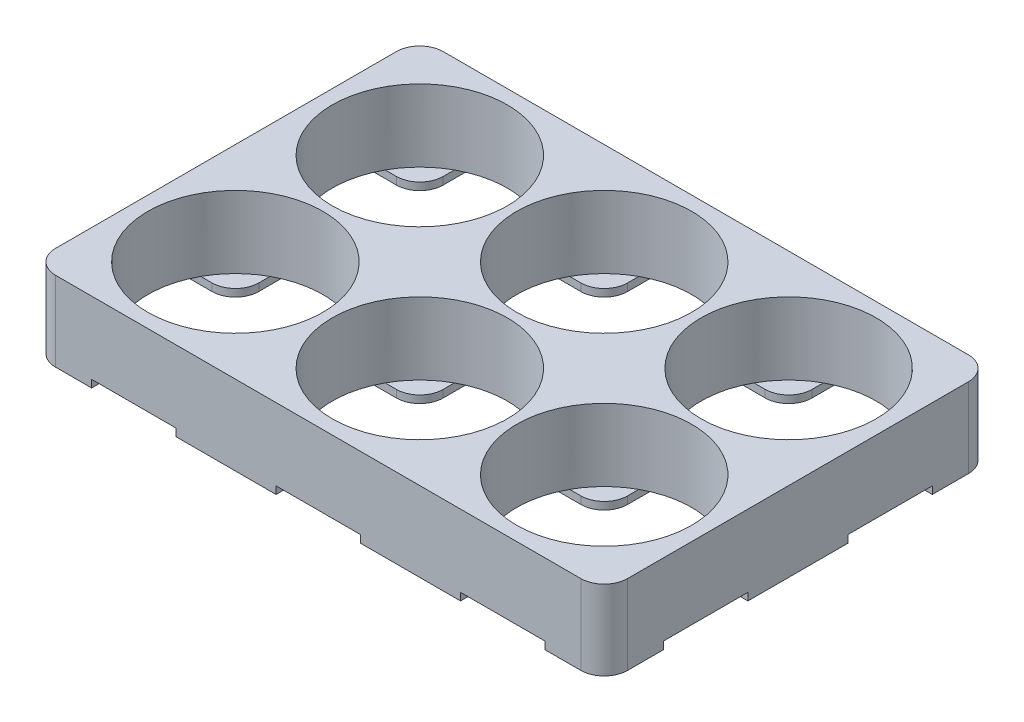
from build123d import *

# Parameters (mm, degrees)
SKETCH3_W                       = 61.1
SKETCH3_H                       = 41.4
SKETCH3_R                       = 9.35
BOSS_EXTRUDE1_DEPTH             = 66
SKETCH4_R                       = 3.080003589
CUT_EXTRUDE1_DEPTH              = 76.616086252
BOSS_EXTRUDE2_REACH             = 77.616
SKETCH5_W                       = 61.1
SKETCH5_H                       = 1
BOSS_EXTRUDE2_DIRECTION_2_REACH = 77.616
CUT_EXTRUDE3_DEPTH              = 76.616086252
CUT_EXTRUDE3_DEPTH_BACK         = 76.616086252
SKETCH5_3_W                     = 58.1
SKETCH5_3_H                     = 49
SKETCH7_R                       = 9.35
CUT_EXTRUDE4_DEPTH              = 76.616086252
BOSS_EXTRUDE3_START             = -20.7
SKETCH8_R                       = 8
SKETCH8_R_2                     = 5.5
BOSS_EXTRUDE3_DEPTH             = 41.4
CUT_EXTRUDE6_DEPTH              = 86.672588965
CUT_EXTRUDE6_DEPTH_BACK         = 86.672588965
SKETCH10_R                      = 8
SKETCH10_R_2                    = 2.25
BOSS_EXTRUDE4_DEPTH             = 5
SKETCH11_W                      = 61.1
SKETCH11_H                      = 41.4
SKETCH11_W_2                    = 58.1
SKETCH11_H_2                    = 38.4
BOSS_EXTRUDE5_DEPTH             = 4
CUT_EXTRUDE7_START              = -0.8
CUT_EXTRUDE7_DEPTH              = 0.8
CUT_EXTRUDE8_START              = -66
CUT_EXTRUDE8_DEPTH              = 0.8
CUT_EXTRUDE9_DEPTH              = 89.790723051
CUT_EXTRUDE9_DEPTH_BACK         = 89.790723051
SKETCH13_W                      = 101.1
SKETCH13_H                      = 61.5
SKETCH13_W_2                    = 20
SKETCH13_H_2                    = 8.5
SKETCH14_W                      = 6.35
SKETCH14_H                      = 9
SKETCH14_W_2                    = 9
SKETCH14_W_3                    = 10.7
SKETCH14_H_2                    = 10.7
SKETCH14_H_3                    = 6.35
CUT_EXTRUDE10_DEPTH             = 0.8
BOSS_EXTRUDE6_DEPTH             = 0.8
FILLET1_R                       = 2.5


with BuildPart() as part:
    # Sketch3 → Boss-Extrude1 (new body)
    with BuildSketch(Plane(origin=(0, 0, 0), x_dir=(1, 0, 0), z_dir=(0, 1, 0))):
        Rectangle(SKETCH3_W, SKETCH3_H)
        with Locations(Location((-19.7, 9.85, 0), (0, 0, 270))):
            Circle(SKETCH3_R, mode=Mode.SUBTRACT)
        with Locations(Location((0, 9.85, 0), (0, 0, 270))):
            Circle(SKETCH3_R, mode=Mode.SUBTRACT)
        with Locations(Location((19.7, 9.85, 0), (0, 0, 270))):
            Circle(SKETCH3_R, mode=Mode.SUBTRACT)
        with Locations(Location((-19.7, -9.85, 0), (0, 0, 270))):
            Circle(SKETCH3_R, mode=Mode.SUBTRACT)
        with Locations(Location((0, -9.85, 0), (0, 0, 270))):
            Circle(SKETCH3_R, mode=Mode.SUBTRACT)
        with Locations(Location((19.7, -9.85, 0), (0, 0, 270))):
            Circle(SKETCH3_R, mode=Mode.SUBTRACT)
    extrude(amount=BOSS_EXTRUDE1_DEPTH)

    # Sketch4 → Cut-Extrude1 (cut, through all)
    with BuildSketch(Plane(origin=(0, 0, 0), x_dir=(1, 0, 0), z_dir=(0, 1, 0))):
        with Locations(Location((-9.85, 0, 0), (0, 0, 270))):
            Circle(SKETCH4_R)
        with Locations(Location((9.85, 0, 0), (0, 0, 270))):
            Circle(SKETCH4_R)
        with BuildLine():
            Line((-4.438468204, 19.2), (-15.261531796, 19.2))
            ThreePointArc((-15.261531796, 19.2), (-12.756480414, 17.525287341), (-10.839977427, 15.2))
            Line((-10.839977427, 15.2), (-8.860022573, 15.2))
            ThreePointArc((-8.860022573, 15.2), (-6.943519586, 17.525287341), (-4.438468204, 19.2))
        make_face()
        with BuildLine():
            Line((15.261531796, 19.2), (4.438468204, 19.2))
            ThreePointArc((4.438468204, 19.2), (6.943519586, 17.525287341), (8.860022573, 15.2))
            Line((8.860022573, 15.2), (10.839977427, 15.2))
            ThreePointArc((10.839977427, 15.2), (12.756480414, 17.525287341), (15.261531796, 19.2))
        make_face()
        with BuildLine():
            Line((29.05, -5.411531796), (29.05, 5.411531796))
            ThreePointArc((29.05, 5.411531796), (27.375287341, 2.906480414), (25.05, 0.989977427))
            Line((25.05, 0.989977427), (25.05, -0.989977427))
            ThreePointArc((25.05, -0.989977427), (27.375287341, -2.906480414), (29.05, -5.411531796))
        make_face()
        with BuildLine():
            Line((29.05, -19.2), (29.05, -14.288468204))
            ThreePointArc((29.05, -14.288468204), (27.018555185, -17.168555185), (24.138468204, -19.2))
            Line((24.138468204, -19.2), (29.05, -19.2))
        make_face()
        with BuildLine():
            Line((29.05, 19.2), (24.138468204, 19.2))
            ThreePointArc((24.138468204, 19.2), (27.018555185, 17.168555185), (29.05, 14.288468204))
            Line((29.05, 14.288468204), (29.05, 19.2))
        make_face()
        with BuildLine():
            ThreePointArc((15.261531796, -19.2), (12.756480414, -17.525287341), (10.839977427, -15.2))
            Line((10.839977427, -15.2), (8.860022573, -15.2))
            ThreePointArc((8.860022573, -15.2), (6.943519586, -17.525287341), (4.438468204, -19.2))
            Line((4.438468204, -19.2), (15.261531796, -19.2))
        make_face()
        with BuildLine():
            ThreePointArc((-4.438468204, -19.2), (-6.943519586, -17.525287341), (-8.860022573, -15.2))
            Line((-8.860022573, -15.2), (-10.839977427, -15.2))
            ThreePointArc((-10.839977427, -15.2), (-12.756480414, -17.525287341), (-15.261531796, -19.2))
            Line((-15.261531796, -19.2), (-4.438468204, -19.2))
        make_face()
        with BuildLine():
            ThreePointArc((-24.138468204, -19.2), (-27.018555185, -17.168555185), (-29.05, -14.288468204))
            Line((-29.05, -14.288468204), (-29.05, -19.2))
            Line((-29.05, -19.2), (-24.138468204, -19.2))
        make_face()
        with BuildLine():
            ThreePointArc((-25.05, 0.989977427), (-27.375287341, 2.906480414), (-29.05, 5.411531796))
            Line((-29.05, 5.411531796), (-29.05, -5.411531796))
            ThreePointArc((-29.05, -5.411531796), (-27.375287341, -2.906480414), (-25.05, -0.989977427))
            Line((-25.05, -0.989977427), (-25.05, 0.989977427))
        make_face()
        with BuildLine():
            ThreePointArc((-29.05, 14.288468204), (-27.018555185, 17.168555185), (-24.138468204, 19.2))
            Line((-24.138468204, 19.2), (-29.05, 19.2))
            Line((-29.05, 19.2), (-29.05, 14.288468204))
        make_face()
    extrude(amount=CUT_EXTRUDE1_DEPTH, mode=Mode.SUBTRACT)

    # Boss-Extrude2: up to this face of the body (flat: up to its plane)
    boss_extrude2_end = Plane(part.part.faces().sort_by_distance((0, 33, 20.7))[0])
    # Sketch5 → Boss-Extrude2 (add, up to the picked face)
    with BuildSketch(Plane.XY, mode=Mode.PRIVATE) as boss_extrude2_sk1:
        with Locations((0, 58)):
            Rectangle(SKETCH5_W, SKETCH5_H)
    boss_extrude2_tool1 = split(extrude(boss_extrude2_sk1.sketch, amount=BOSS_EXTRUDE2_REACH, mode=Mode.PRIVATE), bisect_by=boss_extrude2_end, keep=Keep.BOTH, mode=Mode.PRIVATE)
    # Sketch5 → Boss-Extrude2 (add, up to the picked face)
    with BuildSketch(Plane.XY, mode=Mode.PRIVATE) as boss_extrude2_sk2:
        with Locations((0, 8)):
            Rectangle(SKETCH5_W, SKETCH5_H)
    boss_extrude2_tool2 = split(extrude(boss_extrude2_sk2.sketch, amount=BOSS_EXTRUDE2_REACH, mode=Mode.PRIVATE), bisect_by=boss_extrude2_end, keep=Keep.BOTH, mode=Mode.PRIVATE)
    add(boss_extrude2_tool1.solids().sort_by(Axis((0, 58, 0), (0, 0, 1)))[0])
    add(boss_extrude2_tool2.solids().sort_by(Axis((0, 8, 0), (0, 0, 1)))[0])

    # Boss-Extrude2 direction 2: up to this face of the body (flat: up to its plane)
    boss_extrude2_direction_2_end = Plane(part.part.faces().sort_by_distance((0, 33, -20.7))[0])
    # Sketch5 → Boss-Extrude2 direction 2 (add, up to the picked face)
    with BuildSketch(Plane.XY, mode=Mode.PRIVATE) as boss_extrude2_direction_2_sk1:
        with Locations((0, 58)):
            Rectangle(SKETCH5_W, SKETCH5_H)
    boss_extrude2_direction_2_tool1 = split(extrude(boss_extrude2_direction_2_sk1.sketch, amount=-BOSS_EXTRUDE2_DIRECTION_2_REACH, mode=Mode.PRIVATE), bisect_by=boss_extrude2_direction_2_end, keep=Keep.BOTH, mode=Mode.PRIVATE)
    # Sketch5 → Boss-Extrude2 direction 2 (add, up to the picked face)
    with BuildSketch(Plane.XY, mode=Mode.PRIVATE) as boss_extrude2_direction_2_sk2:
        with Locations((0, 8)):
            Rectangle(SKETCH5_W, SKETCH5_H)
    boss_extrude2_direction_2_tool2 = split(extrude(boss_extrude2_direction_2_sk2.sketch, amount=-BOSS_EXTRUDE2_DIRECTION_2_REACH, mode=Mode.PRIVATE), bisect_by=boss_extrude2_direction_2_end, keep=Keep.BOTH, mode=Mode.PRIVATE)
    add(boss_extrude2_direction_2_tool1.solids().sort_by(Axis((0, 58, 0), (0, 0, -1)))[0])
    add(boss_extrude2_direction_2_tool2.solids().sort_by(Axis((0, 8, 0), (0, 0, -1)))[0])

    # Sketch5<3> → Cut-Extrude3 (cut, two sides: drawn at the far end of the back side and taken through both)
    with BuildSketch(Plane.XY.offset(-CUT_EXTRUDE3_DEPTH_BACK)):
        with Locations((0, 33)):
            Rectangle(SKETCH5_3_W, SKETCH5_3_H)
    extrude(amount=CUT_EXTRUDE3_DEPTH + CUT_EXTRUDE3_DEPTH_BACK, mode=Mode.SUBTRACT)

    # Sketch7 → Cut-Extrude4 (cut, through all)
    with BuildSketch(Plane(origin=(0, 0, 0), x_dir=(1, 0, 0), z_dir=(0, 1, 0))):
        with Locations(Location((-19.7, 9.85, 0), (0, 0, 180))):
            Circle(SKETCH7_R)
        with Locations(Location((0, 9.85, 0), (0, 0, 270))):
            Circle(SKETCH7_R)
        with Locations((19.7, 9.85)):
            Circle(SKETCH7_R)
        with Locations((19.7, -9.85)):
            Circle(SKETCH7_R)
        with Locations(Location((0, -9.85, 0), (0, 0, 270))):
            Circle(SKETCH7_R)
        with Locations(Location((-19.7, -9.85, 0), (0, 0, 180))):
            Circle(SKETCH7_R)
    extrude(amount=CUT_EXTRUDE4_DEPTH, mode=Mode.SUBTRACT)

    # Sketch8 → Boss-Extrude3 (add)
    # profile 1 of 8: a face of its own
    with BuildSketch(Plane.XY.offset(BOSS_EXTRUDE3_START)):
        with BuildLine():
            Line((-30.55, 63.5), (-42.55, 63.5))
            ThreePointArc((-42.55, 63.5), (-36.893145751, 61.156854249), (-34.55, 55.5))
            ThreePointArc((-34.55, 55.5), (-36.893145751, 49.843145751), (-42.55, 47.5))
            Line((-42.55, 47.5), (-30.55, 47.5))
            Line((-30.55, 47.5), (-30.55, 63.5))
        make_face()
    # profile 2 of 8: a face of its own
    with BuildSketch(Plane.XY.offset(BOSS_EXTRUDE3_START)):
        with Locations((-42.55, 55.5)):
            Circle(SKETCH8_R)
        with Locations(Location((-42.55, 55.5, 0), (0, 0, 180))):
            Circle(SKETCH8_R_2, mode=Mode.SUBTRACT)
    # profile 3 of 8: a face of its own
    with BuildSketch(Plane.XY.offset(BOSS_EXTRUDE3_START)):
        with BuildLine():
            Line((30.55, 47.5), (42.55, 47.5))
            ThreePointArc((42.55, 47.5), (34.55, 55.5), (42.55, 63.5))
            Line((42.55, 63.5), (30.55, 63.5))
            Line((30.55, 63.5), (30.55, 47.5))
        make_face()
    # profile 4 of 8: a face of its own
    with BuildSketch(Plane.XY.offset(BOSS_EXTRUDE3_START)):
        with Locations((42.55, 55.5)):
            Circle(SKETCH8_R)
        with Locations(Location((42.55, 55.5, 0), (0, 0, 180))):
            Circle(SKETCH8_R_2, mode=Mode.SUBTRACT)
    # profile 5 of 8: a face of its own
    with BuildSketch(Plane.XY.offset(BOSS_EXTRUDE3_START)):
        with BuildLine():
            Line((30.55, 2.5), (42.55, 2.5))
            ThreePointArc((42.55, 2.5), (34.55, 10.5), (42.55, 18.5))
            Line((42.55, 18.5), (30.55, 18.5))
            Line((30.55, 18.5), (30.55, 2.5))
        make_face()
    # profile 6 of 8: a face of its own
    with BuildSketch(Plane.XY.offset(BOSS_EXTRUDE3_START)):
        with Locations((42.55, 10.5)):
            Circle(SKETCH8_R)
        with Locations(Location((42.55, 10.5, 0), (0, 0, 180))):
            Circle(SKETCH8_R_2, mode=Mode.SUBTRACT)
    # profile 7 of 8: a face of its own
    with BuildSketch(Plane.XY.offset(BOSS_EXTRUDE3_START)):
        with Locations((-42.55, 10.5)):
            Circle(SKETCH8_R)
        with Locations(Location((-42.55, 10.5, 0), (0, 0, 180))):
            Circle(SKETCH8_R_2, mode=Mode.SUBTRACT)
    # profile 8 of 8: a face of its own
    with BuildSketch(Plane.XY.offset(BOSS_EXTRUDE3_START)):
        with BuildLine():
            Line((-30.55, 18.5), (-42.55, 18.5))
            ThreePointArc((-42.55, 18.5), (-36.893145751, 16.156854249), (-34.55, 10.5))
            ThreePointArc((-34.55, 10.5), (-36.893145751, 4.843145751), (-42.55, 2.5))
            Line((-42.55, 2.5), (-30.55, 2.5))
            Line((-30.55, 2.5), (-30.55, 18.5))
        make_face()
    extrude(amount=BOSS_EXTRUDE3_DEPTH)

    # Sketch9 → Cut-Extrude6 (cut, two sides: drawn at the far end of the back side and taken through both)
    with BuildSketch(Plane(origin=(0, 0, 0), x_dir=(1, 0, 0), z_dir=(0, 1, 0)).offset(-CUT_EXTRUDE6_DEPTH_BACK)):
        Polygon((-50.55, -20.7), (-30.55, -20.7), (-30.55, -4.3), (-46.55, 5.7), (-50.55, 5.7), align=None)
        Polygon((30.55, -20.7), (30.55, -4.3), (46.55, 5.7), (50.55, 5.7), (50.55, -20.7), align=None)
    extrude(amount=CUT_EXTRUDE6_DEPTH + CUT_EXTRUDE6_DEPTH_BACK, mode=Mode.SUBTRACT)

    # Sketch10 → Boss-Extrude4 (add)
    # profile 1 of 4: a face of its own
    with BuildSketch(Plane(origin=(0, 0, -20.7), x_dir=(-1, 0, 0), z_dir=(0, 0, -1))):
        with Locations((42.55, 10.5)):
            Circle(SKETCH10_R)
        with Locations((42.55, 10.5)):
            Circle(SKETCH10_R_2, mode=Mode.SUBTRACT)
    # profile 2 of 4: a face of its own
    with BuildSketch(Plane(origin=(0, 0, -20.7), x_dir=(-1, 0, 0), z_dir=(0, 0, -1))):
        with Locations((42.55, 55.5)):
            Circle(SKETCH10_R)
        with Locations((42.55, 55.5)):
            Circle(SKETCH10_R_2, mode=Mode.SUBTRACT)
    # profile 3 of 4: a face of its own
    with BuildSketch(Plane(origin=(0, 0, -20.7), x_dir=(-1, 0, 0), z_dir=(0, 0, -1))):
        with Locations((-42.55, 55.5)):
            Circle(SKETCH10_R)
        with Locations((-42.55, 55.5)):
            Circle(SKETCH10_R_2, mode=Mode.SUBTRACT)
    # profile 4 of 4: a face of its own
    with BuildSketch(Plane(origin=(0, 0, -20.7), x_dir=(-1, 0, 0), z_dir=(0, 0, -1))):
        with Locations((-42.55, 10.5)):
            Circle(SKETCH10_R)
        with Locations((-42.55, 10.5)):
            Circle(SKETCH10_R_2, mode=Mode.SUBTRACT)
    extrude(amount=-BOSS_EXTRUDE4_DEPTH)

    # Sketch11 → Boss-Extrude5 (add)
    with BuildSketch(Plane(origin=(0, 66, 0), x_dir=(1, 0, 0), z_dir=(0, 1, 0))):
        Rectangle(SKETCH11_W, SKETCH11_H)
        Rectangle(SKETCH11_W_2, SKETCH11_H_2, mode=Mode.SUBTRACT)
    extrude(amount=BOSS_EXTRUDE5_DEPTH)

    # Sketch12 → Cut-Extrude7 (cut)
    with BuildSketch(Plane(origin=(0, 66, 0), x_dir=(1, 0, 0), z_dir=(0, 1, 0)).offset(CUT_EXTRUDE7_START)):
        with BuildLine():
            Line((-24.2, 14.35), (-24.2, 1.654116887))
            ThreePointArc((-24.2, 1.654116887), (-19.7, 0.5), (-15.2, 1.654116887))
            Line((-15.2, 1.654116887), (-15.2, 5.35))
            Line((-15.2, 5.35), (-11.504116887, 5.35))
            ThreePointArc((-11.504116887, 5.35), (-10.35, 9.85), (-11.504116887, 14.35))
            Line((-11.504116887, 14.35), (-24.2, 14.35))
        make_face()
        with BuildLine():
            Line((-24.2, -1.654116887), (-24.2, -14.35))
            Line((-24.2, -14.35), (-11.504116887, -14.35))
            ThreePointArc((-11.504116887, -14.35), (-10.35, -9.85), (-11.504116887, -5.35))
            Line((-11.504116887, -5.35), (-15.2, -5.35))
            Line((-15.2, -5.35), (-15.2, -1.654116887))
            ThreePointArc((-15.2, -1.654116887), (-19.7, -0.5), (-24.2, -1.654116887))
        make_face()
        with BuildLine():
            ThreePointArc((-11.504116887, -5.35), (-10.35, -9.85), (-11.504116887, -14.35))
            Line((-11.504116887, -14.35), (-8.195883113, -14.35))
            ThreePointArc((-8.195883113, -14.35), (-9.35, -9.85), (-8.195883113, -5.35))
            Line((-8.195883113, -5.35), (-11.504116887, -5.35))
        make_face()
        with BuildLine():
            ThreePointArc((-8.195883113, -5.35), (-9.35, -9.85), (-8.195883113, -14.35))
            Line((-8.195883113, -14.35), (8.195883113, -14.35))
            ThreePointArc((8.195883113, -14.35), (9.056876037, -12.172820795), (9.35, -9.85))
            ThreePointArc((9.35, -9.85), (9.056876037, -7.527179205), (8.195883113, -5.35))
            Line((8.195883113, -5.35), (4.5, -5.35))
            Line((4.5, -5.35), (4.5, -1.654116887))
            ThreePointArc((4.5, -1.654116887), (0, -0.5), (-4.5, -1.654116887))
            Line((-4.5, -1.654116887), (-4.5, -5.35))
            Line((-4.5, -5.35), (-8.195883113, -5.35))
        make_face()
        with BuildLine():
            Line((-4.5, 5.35), (-4.5, 1.654116887))
            ThreePointArc((-4.5, 1.654116887), (0, 0.5), (4.5, 1.654116887))
            Line((4.5, 1.654116887), (4.5, 5.35))
            Line((4.5, 5.35), (8.195883113, 5.35))
            ThreePointArc((8.195883113, 5.35), (9.056876037, 7.527179205), (9.35, 9.85))
            ThreePointArc((9.35, 9.85), (9.056876037, 12.172820795), (8.195883113, 14.35))
            Line((8.195883113, 14.35), (-8.195883113, 14.35))
            ThreePointArc((-8.195883113, 14.35), (-9.35, 9.85), (-8.195883113, 5.35))
            Line((-8.195883113, 5.35), (-4.5, 5.35))
        make_face()
        with BuildLine():
            Line((-8.195883113, 14.35), (-11.504116887, 14.35))
            ThreePointArc((-11.504116887, 14.35), (-10.35, 9.85), (-11.504116887, 5.35))
            Line((-11.504116887, 5.35), (-8.195883113, 5.35))
            ThreePointArc((-8.195883113, 5.35), (-9.35, 9.85), (-8.195883113, 14.35))
        make_face()
        with BuildLine():
            Line((-4.5, 1.654116887), (-4.5, -1.654116887))
            ThreePointArc((-4.5, -1.654116887), (0, -0.5), (4.5, -1.654116887))
            Line((4.5, -1.654116887), (4.5, 1.654116887))
            ThreePointArc((4.5, 1.654116887), (0, 0.5), (-4.5, 1.654116887))
        make_face()
        with BuildLine():
            ThreePointArc((11.504116887, -5.35), (10.35, -9.85), (11.504116887, -14.35))
            Line((11.504116887, -14.35), (24.2, -14.35))
            Line((24.2, -14.35), (24.2, -1.654116887))
            ThreePointArc((24.2, -1.654116887), (19.7, -0.5), (15.2, -1.654116887))
            Line((15.2, -1.654116887), (15.2, -5.35))
            Line((15.2, -5.35), (11.504116887, -5.35))
        make_face()
        with BuildLine():
            Line((24.2, 14.35), (11.504116887, 14.35))
            ThreePointArc((11.504116887, 14.35), (10.35, 9.85), (11.504116887, 5.35))
            Line((11.504116887, 5.35), (15.2, 5.35))
            Line((15.2, 5.35), (15.2, 1.654116887))
            ThreePointArc((15.2, 1.654116887), (19.7, 0.5), (24.2, 1.654116887))
            Line((24.2, 1.654116887), (24.2, 14.35))
        make_face()
        with BuildLine():
            Line((15.2, 0), (24.2, 0))
            Line((24.2, 0), (24.2, 1.654116887))
            ThreePointArc((24.2, 1.654116887), (19.7, 0.5), (15.2, 1.654116887))
            Line((15.2, 1.654116887), (15.2, 0))
        make_face()
        with BuildLine():
            ThreePointArc((15.2, -1.654116887), (19.7, -0.5), (24.2, -1.654116887))
            Line((24.2, -1.654116887), (24.2, 0))
            Line((24.2, 0), (15.2, 0))
            Line((15.2, 0), (15.2, -1.654116887))
        make_face()
        with BuildLine():
            ThreePointArc((9.35, -9.85), (9.056876037, -12.172820795), (8.195883113, -14.35))
            Line((8.195883113, -14.35), (11.504116887, -14.35))
            ThreePointArc((11.504116887, -14.35), (10.35, -9.85), (11.504116887, -5.35))
            Line((11.504116887, -5.35), (8.195883113, -5.35))
            ThreePointArc((8.195883113, -5.35), (9.056876037, -7.527179205), (9.35, -9.85))
        make_face()
        with BuildLine():
            Line((11.504116887, 14.35), (8.195883113, 14.35))
            ThreePointArc((8.195883113, 14.35), (9.056876037, 12.172820795), (9.35, 9.85))
            ThreePointArc((9.35, 9.85), (9.056876037, 7.527179205), (8.195883113, 5.35))
            Line((8.195883113, 5.35), (11.504116887, 5.35))
            ThreePointArc((11.504116887, 5.35), (10.35, 9.85), (11.504116887, 14.35))
        make_face()
        with BuildLine():
            Line((-24.2, 1.654116887), (-24.2, -1.654116887))
            ThreePointArc((-24.2, -1.654116887), (-19.7, -0.5), (-15.2, -1.654116887))
            Line((-15.2, -1.654116887), (-15.2, 1.654116887))
            ThreePointArc((-15.2, 1.654116887), (-19.7, 0.5), (-24.2, 1.654116887))
        make_face()
    extrude(amount=CUT_EXTRUDE7_DEPTH, mode=Mode.SUBTRACT)

    # Sketch12<3> → Cut-Extrude8 (cut)
    with BuildSketch(Plane(origin=(0, 66, 0), x_dir=(1, 0, 0), z_dir=(0, 1, 0)).offset(CUT_EXTRUDE8_START)):
        with BuildLine():
            Line((-24.2, 14.35), (-24.2, 1.654116887))
            ThreePointArc((-24.2, 1.654116887), (-19.7, 0.5), (-15.2, 1.654116887))
            Line((-15.2, 1.654116887), (-15.2, 5.35))
            Line((-15.2, 5.35), (-11.504116887, 5.35))
            ThreePointArc((-11.504116887, 5.35), (-10.35, 9.85), (-11.504116887, 14.35))
            Line((-11.504116887, 14.35), (-24.2, 14.35))
        make_face()
        with BuildLine():
            Line((-24.2, -1.654116887), (-24.2, -14.35))
            Line((-24.2, -14.35), (-11.504116887, -14.35))
            ThreePointArc((-11.504116887, -14.35), (-10.35, -9.85), (-11.504116887, -5.35))
            Line((-11.504116887, -5.35), (-15.2, -5.35))
            Line((-15.2, -5.35), (-15.2, -1.654116887))
            ThreePointArc((-15.2, -1.654116887), (-19.7, -0.5), (-24.2, -1.654116887))
        make_face()
        with BuildLine():
            Line((-24.2, 1.654116887), (-24.2, -1.654116887))
            ThreePointArc((-24.2, -1.654116887), (-19.7, -0.5), (-15.2, -1.654116887))
            Line((-15.2, -1.654116887), (-15.2, 1.654116887))
            ThreePointArc((-15.2, 1.654116887), (-19.7, 0.5), (-24.2, 1.654116887))
        make_face()
        with BuildLine():
            ThreePointArc((-11.504116887, -5.35), (-10.35, -9.85), (-11.504116887, -14.35))
            Line((-11.504116887, -14.35), (-8.195883113, -14.35))
            ThreePointArc((-8.195883113, -14.35), (-9.35, -9.85), (-8.195883113, -5.35))
            Line((-8.195883113, -5.35), (-11.504116887, -5.35))
        make_face()
        with BuildLine():
            Line((-8.195883113, 14.35), (-11.504116887, 14.35))
            ThreePointArc((-11.504116887, 14.35), (-10.35, 9.85), (-11.504116887, 5.35))
            Line((-11.504116887, 5.35), (-8.195883113, 5.35))
            ThreePointArc((-8.195883113, 5.35), (-9.35, 9.85), (-8.195883113, 14.35))
        make_face()
        with BuildLine():
            Line((-4.5, 5.35), (-4.5, 1.654116887))
            ThreePointArc((-4.5, 1.654116887), (0, 0.5), (4.5, 1.654116887))
            Line((4.5, 1.654116887), (4.5, 5.35))
            Line((4.5, 5.35), (8.195883113, 5.35))
            ThreePointArc((8.195883113, 5.35), (9.056876037, 7.527179205), (9.35, 9.85))
            ThreePointArc((9.35, 9.85), (9.056876037, 12.172820795), (8.195883113, 14.35))
            Line((8.195883113, 14.35), (-8.195883113, 14.35))
            ThreePointArc((-8.195883113, 14.35), (-9.35, 9.85), (-8.195883113, 5.35))
            Line((-8.195883113, 5.35), (-4.5, 5.35))
        make_face()
        with BuildLine():
            ThreePointArc((-8.195883113, -5.35), (-9.35, -9.85), (-8.195883113, -14.35))
            Line((-8.195883113, -14.35), (8.195883113, -14.35))
            ThreePointArc((8.195883113, -14.35), (9.056876037, -12.172820795), (9.35, -9.85))
            ThreePointArc((9.35, -9.85), (9.056876037, -7.527179205), (8.195883113, -5.35))
            Line((8.195883113, -5.35), (4.5, -5.35))
            Line((4.5, -5.35), (4.5, -1.654116887))
            ThreePointArc((4.5, -1.654116887), (0, -0.5), (-4.5, -1.654116887))
            Line((-4.5, -1.654116887), (-4.5, -5.35))
            Line((-4.5, -5.35), (-8.195883113, -5.35))
        make_face()
        with BuildLine():
            Line((-4.5, 1.654116887), (-4.5, -1.654116887))
            ThreePointArc((-4.5, -1.654116887), (0, -0.5), (4.5, -1.654116887))
            Line((4.5, -1.654116887), (4.5, 1.654116887))
            ThreePointArc((4.5, 1.654116887), (0, 0.5), (-4.5, 1.654116887))
        make_face()
        with BuildLine():
            ThreePointArc((11.504116887, -5.35), (10.35, -9.85), (11.504116887, -14.35))
            Line((11.504116887, -14.35), (24.2, -14.35))
            Line((24.2, -14.35), (24.2, -1.654116887))
            ThreePointArc((24.2, -1.654116887), (19.7, -0.5), (15.2, -1.654116887))
            Line((15.2, -1.654116887), (15.2, -5.35))
            Line((15.2, -5.35), (11.504116887, -5.35))
        make_face()
        with BuildLine():
            Line((24.2, 14.35), (11.504116887, 14.35))
            ThreePointArc((11.504116887, 14.35), (10.35, 9.85), (11.504116887, 5.35))
            Line((11.504116887, 5.35), (15.2, 5.35))
            Line((15.2, 5.35), (15.2, 1.654116887))
            ThreePointArc((15.2, 1.654116887), (19.7, 0.5), (24.2, 1.654116887))
            Line((24.2, 1.654116887), (24.2, 14.35))
        make_face()
        with BuildLine():
            Line((11.504116887, 14.35), (8.195883113, 14.35))
            ThreePointArc((8.195883113, 14.35), (9.056876037, 12.172820795), (9.35, 9.85))
            ThreePointArc((9.35, 9.85), (9.056876037, 7.527179205), (8.195883113, 5.35))
            Line((8.195883113, 5.35), (11.504116887, 5.35))
            ThreePointArc((11.504116887, 5.35), (10.35, 9.85), (11.504116887, 14.35))
        make_face()
        with BuildLine():
            ThreePointArc((9.35, -9.85), (9.056876037, -12.172820795), (8.195883113, -14.35))
            Line((8.195883113, -14.35), (11.504116887, -14.35))
            ThreePointArc((11.504116887, -14.35), (10.35, -9.85), (11.504116887, -5.35))
            Line((11.504116887, -5.35), (8.195883113, -5.35))
            ThreePointArc((8.195883113, -5.35), (9.056876037, -7.527179205), (9.35, -9.85))
        make_face()
        with BuildLine():
            ThreePointArc((15.2, -1.654116887), (19.7, -0.5), (24.2, -1.654116887))
            Line((24.2, -1.654116887), (24.2, 0))
            Line((24.2, 0), (15.2, 0))
            Line((15.2, 0), (15.2, -1.654116887))
        make_face()
        with BuildLine():
            Line((15.2, 0), (24.2, 0))
            Line((24.2, 0), (24.2, 1.654116887))
            ThreePointArc((24.2, 1.654116887), (19.7, 0.5), (15.2, 1.654116887))
            Line((15.2, 1.654116887), (15.2, 0))
        make_face()
    extrude(amount=CUT_EXTRUDE8_DEPTH, mode=Mode.SUBTRACT)

    # Sketch13 → Cut-Extrude9 (cut, two sides: drawn at the far end of the back side and taken through both)
    with BuildSketch(Plane.XY.offset(-CUT_EXTRUDE9_DEPTH_BACK)):
        with Locations((0, 39.25)):
            Rectangle(SKETCH13_W, SKETCH13_H)
        with Locations((-40.55, 4.25)):
            Rectangle(SKETCH13_W_2, SKETCH13_H_2)
        with Locations((40.55, 4.25)):
            Rectangle(SKETCH13_W_2, SKETCH13_H_2)
    extrude(amount=CUT_EXTRUDE9_DEPTH + CUT_EXTRUDE9_DEPTH_BACK, mode=Mode.SUBTRACT)

    # Sketch14 → Cut-Extrude10 (cut)
    with BuildSketch(Plane.XZ):
        with Locations((27.375, -9.85)):
            Rectangle(SKETCH14_W, SKETCH14_H)
        with Locations((19.7, -9.85)):
            Rectangle(SKETCH14_W_2, SKETCH14_H)
        with Locations((9.85, -9.85)):
            Rectangle(SKETCH14_W_3, SKETCH14_H)
        with Locations((0, -9.85)):
            Rectangle(SKETCH14_W_2, SKETCH14_H)
        with Locations((-9.85, -9.85)):
            Rectangle(SKETCH14_W_3, SKETCH14_H)
        with Locations((-19.7, -9.85)):
            Rectangle(SKETCH14_W_2, SKETCH14_H)
        with Locations((-27.375, -9.85)):
            Rectangle(SKETCH14_W, SKETCH14_H)
        with Locations((-27.375, 9.85)):
            Rectangle(SKETCH14_W, SKETCH14_H)
        with Locations((-19.7, 9.85)):
            Rectangle(SKETCH14_W_2, SKETCH14_H)
        with Locations((-9.85, 9.85)):
            Rectangle(SKETCH14_W_3, SKETCH14_H)
        with Locations((0, 9.85)):
            Rectangle(SKETCH14_W_2, SKETCH14_H)
        with Locations((9.85, 9.85)):
            Rectangle(SKETCH14_W_3, SKETCH14_H)
        with Locations((19.7, 9.85)):
            Rectangle(SKETCH14_W_2, SKETCH14_H)
        with Locations((27.375, 9.85)):
            Rectangle(SKETCH14_W, SKETCH14_H)
        with Locations((19.7, 0)):
            Rectangle(SKETCH14_W_2, SKETCH14_H_2)
        Rectangle(SKETCH14_W_2, SKETCH14_H_2)
        with Locations((-19.7, 0)):
            Rectangle(SKETCH14_W_2, SKETCH14_H_2)
        with Locations((-19.7, 17.525)):
            Rectangle(SKETCH14_W_2, SKETCH14_H_3)
        with Locations((19.7, 17.525)):
            Rectangle(SKETCH14_W_2, SKETCH14_H_3)
        with Locations((0, 17.525)):
            Rectangle(SKETCH14_W_2, SKETCH14_H_3)
        with Locations((19.7, -17.525)):
            Rectangle(SKETCH14_W_2, SKETCH14_H_3)
        with Locations((0, -17.525)):
            Rectangle(SKETCH14_W_2, SKETCH14_H_3)
        with Locations((-19.7, -17.525)):
            Rectangle(SKETCH14_W_2, SKETCH14_H_3)
    extrude(amount=-CUT_EXTRUDE10_DEPTH, mode=Mode.SUBTRACT)

    # Sketch16 → Boss-Extrude6 (add)
    with BuildSketch(Plane.XZ):
        with BuildLine():
            Line((24.2, -14.35), (24.2, -19.17054183))
            ThreePointArc((24.2, -19.17054183), (27.018555185, -17.168555185), (29.02054183, -14.35))
            Line((29.02054183, -14.35), (24.2, -14.35))
        make_face()
        with BuildLine():
            Line((15.2, -14.35), (10.37945817, -14.35))
            ThreePointArc((10.37945817, -14.35), (12.381444815, -17.168555185), (15.2, -19.17054183))
            Line((15.2, -19.17054183), (15.2, -14.35))
        make_face()
        with BuildLine():
            ThreePointArc((29.02054183, -5.35), (27.018555185, -2.531444815), (24.2, -0.52945817))
            Line((24.2, -0.52945817), (24.2, -5.35))
            Line((24.2, -5.35), (29.02054183, -5.35))
        make_face()
        with BuildLine():
            Line((10.37945817, -5.35), (15.2, -5.35))
            Line((15.2, -5.35), (15.2, -0.52945817))
            ThreePointArc((15.2, -0.52945817), (12.381444815, -2.531444815), (10.37945817, -5.35))
        make_face()
        with BuildLine():
            Line((4.5, -5.35), (9.32054183, -5.35))
            ThreePointArc((9.32054183, -5.35), (7.318555185, -2.531444815), (4.5, -0.52945817))
            Line((4.5, -0.52945817), (4.5, -5.35))
        make_face()
        with BuildLine():
            Line((-4.5, -5.35), (-4.5, -0.52945817))
            ThreePointArc((-4.5, -0.52945817), (-7.318555185, -2.531444815), (-9.32054183, -5.35))
            Line((-9.32054183, -5.35), (-4.5, -5.35))
        make_face()
        with BuildLine():
            ThreePointArc((4.5, -19.17054183), (7.318555185, -17.168555185), (9.32054183, -14.35))
            Line((9.32054183, -14.35), (4.5, -14.35))
            Line((4.5, -14.35), (4.5, -19.17054183))
        make_face()
        with BuildLine():
            ThreePointArc((-9.32054183, -14.35), (-7.318555185, -17.168555185), (-4.5, -19.17054183))
            Line((-4.5, -19.17054183), (-4.5, -14.35))
            Line((-4.5, -14.35), (-9.32054183, -14.35))
        make_face()
        with BuildLine():
            ThreePointArc((-15.2, -19.17054183), (-12.381444815, -17.168555185), (-10.37945817, -14.35))
            Line((-10.37945817, -14.35), (-15.2, -14.35))
            Line((-15.2, -14.35), (-15.2, -19.17054183))
        make_face()
        with BuildLine():
            ThreePointArc((-29.02054183, -14.35), (-27.018555185, -17.168555185), (-24.2, -19.17054183))
            Line((-24.2, -19.17054183), (-24.2, -14.35))
            Line((-24.2, -14.35), (-29.02054183, -14.35))
        make_face()
        with BuildLine():
            Line((-24.2, -5.35), (-24.2, -0.52945817))
            ThreePointArc((-24.2, -0.52945817), (-27.018555185, -2.531444815), (-29.02054183, -5.35))
            Line((-29.02054183, -5.35), (-24.2, -5.35))
        make_face()
        with BuildLine():
            Line((-15.2, -5.35), (-10.37945817, -5.35))
            ThreePointArc((-10.37945817, -5.35), (-12.381444815, -2.531444815), (-15.2, -0.52945817))
            Line((-15.2, -0.52945817), (-15.2, -5.35))
        make_face()
        with BuildLine():
            Line((24.2, 5.35), (24.2, 0.52945817))
            ThreePointArc((24.2, 0.52945817), (27.018555185, 2.531444815), (29.02054183, 5.35))
            Line((29.02054183, 5.35), (24.2, 5.35))
        make_face()
        with BuildLine():
            ThreePointArc((10.37945817, 5.35), (12.381444815, 2.531444815), (15.2, 0.52945817))
            Line((15.2, 0.52945817), (15.2, 5.35))
            Line((15.2, 5.35), (10.37945817, 5.35))
        make_face()
        with BuildLine():
            Line((4.5, 5.35), (4.5, 0.52945817))
            ThreePointArc((4.5, 0.52945817), (7.318555185, 2.531444815), (9.32054183, 5.35))
            Line((9.32054183, 5.35), (4.5, 5.35))
        make_face()
        with BuildLine():
            ThreePointArc((-9.32054183, 5.35), (-7.318555185, 2.531444815), (-4.5, 0.52945817))
            Line((-4.5, 0.52945817), (-4.5, 5.35))
            Line((-4.5, 5.35), (-9.32054183, 5.35))
        make_face()
        with BuildLine():
            ThreePointArc((-15.2, 0.52945817), (-12.381444815, 2.531444815), (-10.37945817, 5.35))
            Line((-10.37945817, 5.35), (-15.2, 5.35))
            Line((-15.2, 5.35), (-15.2, 0.52945817))
        make_face()
        with BuildLine():
            ThreePointArc((-29.02054183, 5.35), (-27.018555185, 2.531444815), (-24.2, 0.52945817))
            Line((-24.2, 0.52945817), (-24.2, 5.35))
            Line((-24.2, 5.35), (-29.02054183, 5.35))
        make_face()
        with BuildLine():
            Line((-24.2, 14.35), (-24.2, 19.17054183))
            ThreePointArc((-24.2, 19.17054183), (-27.018555185, 17.168555185), (-29.02054183, 14.35))
            Line((-29.02054183, 14.35), (-24.2, 14.35))
        make_face()
        with BuildLine():
            Line((-15.2, 14.35), (-10.37945817, 14.35))
            ThreePointArc((-10.37945817, 14.35), (-12.381444815, 17.168555185), (-15.2, 19.17054183))
            Line((-15.2, 19.17054183), (-15.2, 14.35))
        make_face()
        with BuildLine():
            Line((-4.5, 14.35), (-4.5, 19.17054183))
            ThreePointArc((-4.5, 19.17054183), (-7.318555185, 17.168555185), (-9.32054183, 14.35))
            Line((-9.32054183, 14.35), (-4.5, 14.35))
        make_face()
        with BuildLine():
            Line((4.5, 14.35), (9.32054183, 14.35))
            ThreePointArc((9.32054183, 14.35), (7.318555185, 17.168555185), (4.5, 19.17054183))
            Line((4.5, 19.17054183), (4.5, 14.35))
        make_face()
        with BuildLine():
            ThreePointArc((15.2, 19.17054183), (12.381444815, 17.168555185), (10.37945817, 14.35))
            Line((10.37945817, 14.35), (15.2, 14.35))
            Line((15.2, 14.35), (15.2, 19.17054183))
        make_face()
        with BuildLine():
            Line((24.2, 14.35), (29.02054183, 14.35))
            ThreePointArc((29.02054183, 14.35), (27.018555185, 17.168555185), (24.2, 19.17054183))
            Line((24.2, 19.17054183), (24.2, 14.35))
        make_face()
    extrude(amount=-BOSS_EXTRUDE6_DEPTH)

    # Fillet1
    fillet1_edges = [part.edges().sort_by_distance(p)[0] for p in [
        (30.55, 4.25, 20.7),
        (-30.55, 4.25, 20.7),
        (24.2, 0.4, -14.35),
        (15.2, 0.4, -14.35),
        (24.2, 0.4, -5.35),
        (15.2, 0.4, -5.35),
        (4.5, 0.4, -5.35),
        (-4.5, 0.4, -5.35),
        (4.5, 0.4, -14.35),
        (-4.5, 0.4, -14.35),
        (-15.2, 0.4, -14.35),
        (-24.2, 0.4, -14.35),
        (-24.2, 0.4, -5.35),
        (-15.2, 0.4, -5.35),
        (24.2, 0.4, 5.35),
        (15.2, 0.4, 5.35),
        (4.5, 0.4, 5.35),
        (-4.5, 0.4, 5.35),
        (-15.2, 0.4, 5.35),
        (-24.2, 0.4, 5.35),
        (-24.2, 0.4, 14.35),
        (-15.2, 0.4, 14.35),
        (-4.5, 0.4, 14.35),
        (4.5, 0.4, 14.35),
        (15.2, 0.4, 14.35),
        (24.2, 0.4, 14.35),
        (-29.05, 3.75, -19.2),
        (-29.05, 3.75, 19.2),
        (29.05, 3.75, 19.2),
        (29.05, 3.75, -19.2),
        (30.55, 4.25, -20.7),
        (-30.55, 4.25, -20.7),
    ]]
    fillet(fillet1_edges, radius=FILLET1_R)


solid = part.part
